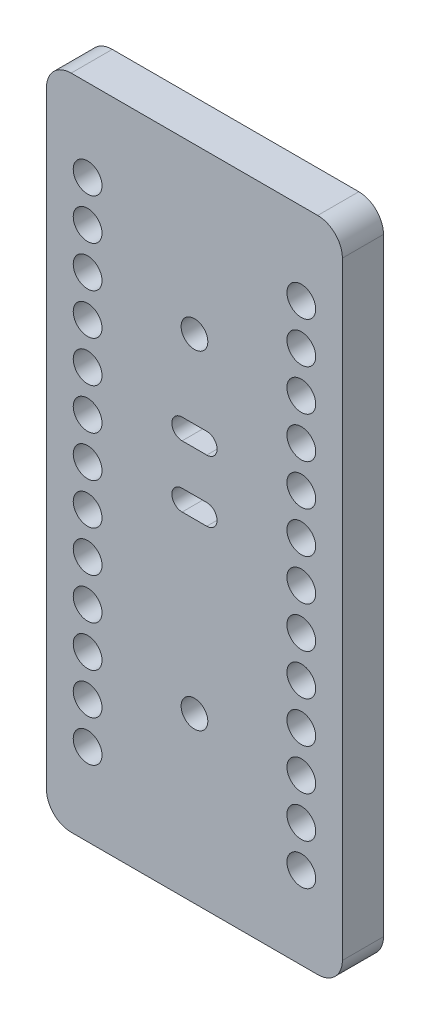
from build123d import *

# Parameters (mm, degrees)
SKETCH1_W           = 16
SKETCH1_H           = 80
SKETCH1_R           = 1.625
BOSS_EXTRUDE1_DEPTH = 5
SKETCH2_R           = 1.75
BOSS_EXTRUDE2_DEPTH = 5


with BuildPart() as part:
    # Sketch1 → Boss-Extrude1 (new body)
    with BuildSketch(Plane.XY):
        with Locations((8, 40)):
            Rectangle(SKETCH1_W, SKETCH1_H)
        with Locations((8, 20)):
            Circle(SKETCH1_R, mode=Mode.SUBTRACT)
        with Locations((8, 60)):
            Circle(SKETCH1_R, mode=Mode.SUBTRACT)
        with BuildLine():
            Line((6.5, 50.5), (9.5, 50.5))
            ThreePointArc((9.5, 50.5), (10.75, 49.25), (9.5, 48))
            Line((9.5, 48), (6.5, 48))
            ThreePointArc((6.5, 48), (5.25, 49.25), (6.5, 50.5))
        make_face(mode=Mode.SUBTRACT)
        with BuildLine():
            Line((6.5, 43), (9.5, 43))
            ThreePointArc((9.5, 43), (10.75, 41.75), (9.5, 40.5))
            Line((9.5, 40.5), (6.5, 40.5))
            ThreePointArc((6.5, 40.5), (5.25, 41.75), (6.5, 43))
        make_face(mode=Mode.SUBTRACT)
    extrude(amount=BOSS_EXTRUDE1_DEPTH)

    # Sketch2 → Boss-Extrude2 (add)
    # profile 1 of 2: a face of its own
    with BuildSketch(Plane.XY.offset(5)):
        with BuildLine():
            Line((16, 80), (23, 80))
            ThreePointArc((23, 80), (25.121320344, 79.121320344), (26, 77))
            Line((26, 77), (26, 3))
            ThreePointArc((26, 3), (25.121320344, 0.878679656), (23, 0))
            Line((23, 0), (16, 0))
            Line((16, 0), (16, 80))
        make_face()
        with Locations((21, 70)):
            Circle(SKETCH2_R, mode=Mode.SUBTRACT)
        with Locations((21, 65)):
            Circle(SKETCH2_R, mode=Mode.SUBTRACT)
        with Locations((21, 60)):
            Circle(SKETCH2_R, mode=Mode.SUBTRACT)
        with Locations((21, 55)):
            Circle(SKETCH2_R, mode=Mode.SUBTRACT)
        with Locations((21, 50)):
            Circle(SKETCH2_R, mode=Mode.SUBTRACT)
        with Locations((21, 45)):
            Circle(SKETCH2_R, mode=Mode.SUBTRACT)
        with Locations((21, 40)):
            Circle(SKETCH2_R, mode=Mode.SUBTRACT)
        with Locations((21, 35)):
            Circle(SKETCH2_R, mode=Mode.SUBTRACT)
        with Locations((21, 30)):
            Circle(SKETCH2_R, mode=Mode.SUBTRACT)
        with Locations((21, 25)):
            Circle(SKETCH2_R, mode=Mode.SUBTRACT)
        with Locations((21, 20)):
            Circle(SKETCH2_R, mode=Mode.SUBTRACT)
        with Locations((21, 15)):
            Circle(SKETCH2_R, mode=Mode.SUBTRACT)
        with Locations((21, 10)):
            Circle(SKETCH2_R, mode=Mode.SUBTRACT)
    # profile 2 of 2: a face of its own
    with BuildSketch(Plane.XY.offset(5)):
        with BuildLine():
            Line((0, 0), (0, 80))
            Line((0, 80), (-7, 80))
            ThreePointArc((-7, 80), (-9.121320344, 79.121320344), (-10, 77))
            Line((-10, 77), (-10, 3))
            ThreePointArc((-10, 3), (-9.121320344, 0.878679656), (-7, 0))
            Line((-7, 0), (0, 0))
        make_face()
        with Locations(Location((-5, 10, 0), (0, 0, 180))):
            Circle(SKETCH2_R, mode=Mode.SUBTRACT)
        with Locations(Location((-5, 15, 0), (0, 0, 180))):
            Circle(SKETCH2_R, mode=Mode.SUBTRACT)
        with Locations(Location((-5, 20, 0), (0, 0, 180))):
            Circle(SKETCH2_R, mode=Mode.SUBTRACT)
        with Locations(Location((-5, 25, 0), (0, 0, 180))):
            Circle(SKETCH2_R, mode=Mode.SUBTRACT)
        with Locations(Location((-5, 30, 0), (0, 0, 180))):
            Circle(SKETCH2_R, mode=Mode.SUBTRACT)
        with Locations(Location((-5, 35, 0), (0, 0, 180))):
            Circle(SKETCH2_R, mode=Mode.SUBTRACT)
        with Locations(Location((-5, 40, 0), (0, 0, 180))):
            Circle(SKETCH2_R, mode=Mode.SUBTRACT)
        with Locations(Location((-5, 45, 0), (0, 0, 180))):
            Circle(SKETCH2_R, mode=Mode.SUBTRACT)
        with Locations(Location((-5, 50, 0), (0, 0, 180))):
            Circle(SKETCH2_R, mode=Mode.SUBTRACT)
        with Locations(Location((-5, 55, 0), (0, 0, 180))):
            Circle(SKETCH2_R, mode=Mode.SUBTRACT)
        with Locations(Location((-5, 60, 0), (0, 0, 180))):
            Circle(SKETCH2_R, mode=Mode.SUBTRACT)
        with Locations(Location((-5, 65, 0), (0, 0, 180))):
            Circle(SKETCH2_R, mode=Mode.SUBTRACT)
        with Locations(Location((-5, 70, 0), (0, 0, 180))):
            Circle(SKETCH2_R, mode=Mode.SUBTRACT)
    extrude(amount=-BOSS_EXTRUDE2_DEPTH)


solid = part.part
